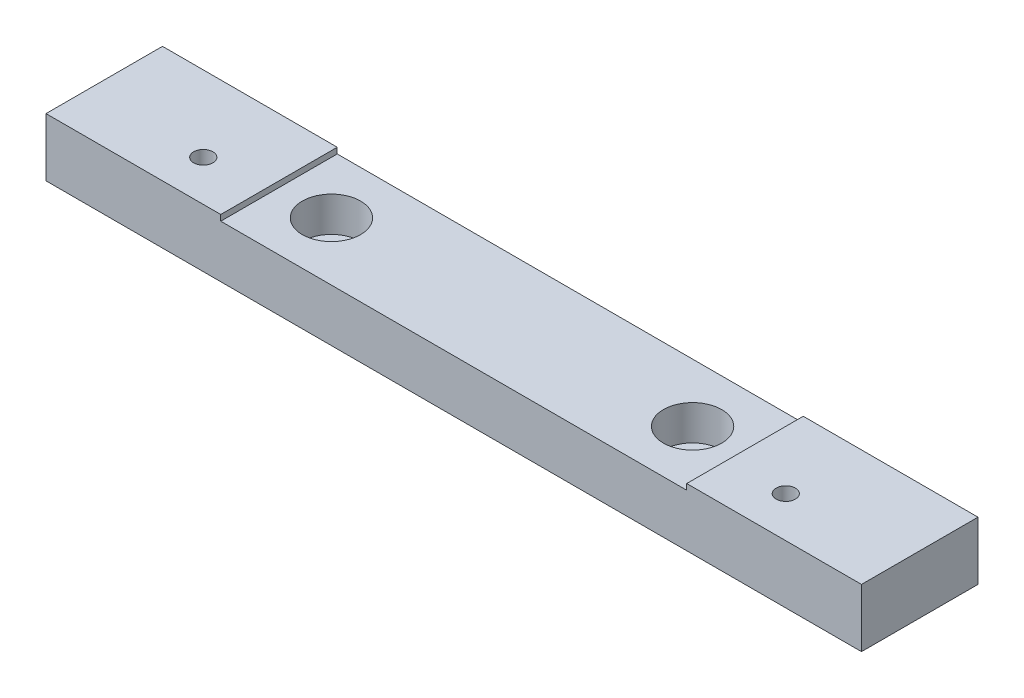
from build123d import *

# Parameters (mm, degrees)
SKETCH1_W           = 140
SKETCH1_H           = 20
BOSS_EXTRUDE1_DEPTH = 10
SKETCH2_W           = 80
SKETCH2_H           = 20
CUT_EXTRUDE1_DEPTH  = 1
SKETCH3_R           = 2.75
CUT_EXTRUDE2_DEPTH  = 9
SKETCH4_R           = 5
CUT_EXTRUDE3_DEPTH  = 6
SKETCH5_R           = 1.65
CUT_EXTRUDE4_DEPTH  = 10


with BuildPart() as part:
    # Sketch1 → Boss-Extrude1 (new body)
    with BuildSketch(Plane(origin=(0, 0, 0), x_dir=(1, 0, 0), z_dir=(0, 1, 0))):
        Rectangle(SKETCH1_W, SKETCH1_H)
    extrude(amount=BOSS_EXTRUDE1_DEPTH)

    # Sketch2 → Cut-Extrude1 (cut)
    with BuildSketch(Plane(origin=(0, 10, 0), x_dir=(1, 0, 0), z_dir=(0, 1, 0))):
        Rectangle(SKETCH2_W, SKETCH2_H)
    extrude(amount=-CUT_EXTRUDE1_DEPTH, mode=Mode.SUBTRACT)

    # Sketch3 → Cut-Extrude2 (cut)
    with BuildSketch(Plane(origin=(0, 9, 0), x_dir=(1, 0, 0), z_dir=(0, 1, 0))):
        with Locations(Location((31, 0, 0), (0, 0, 270))):
            Circle(SKETCH3_R)
        with Locations(Location((-31, 0, 0), (0, 0, 270))):
            Circle(SKETCH3_R)
    extrude(amount=-CUT_EXTRUDE2_DEPTH, mode=Mode.SUBTRACT)

    # Sketch4 → Cut-Extrude3 (cut)
    with BuildSketch(Plane(origin=(0, 9, 0), x_dir=(1, 0, 0), z_dir=(0, 1, 0))):
        with Locations(Location((31, 0, 0), (0, 0, 270))):
            Circle(SKETCH4_R)
        with Locations(Location((-31, 0, 0), (0, 0, 270))):
            Circle(SKETCH4_R)
    extrude(amount=-CUT_EXTRUDE3_DEPTH, mode=Mode.SUBTRACT)

    # Sketch5 → Cut-Extrude4 (cut)
    with BuildSketch(Plane(origin=(0, 10, 0), x_dir=(1, 0, 0), z_dir=(0, 1, 0))):
        with Locations(Location((-50, -3, 0), (0, 0, 270))):
            Circle(SKETCH5_R)
        with Locations(Location((50, -3, 0), (0, 0, 270))):
            Circle(SKETCH5_R)
    extrude(amount=-CUT_EXTRUDE4_DEPTH, mode=Mode.SUBTRACT)


solid = part.part
